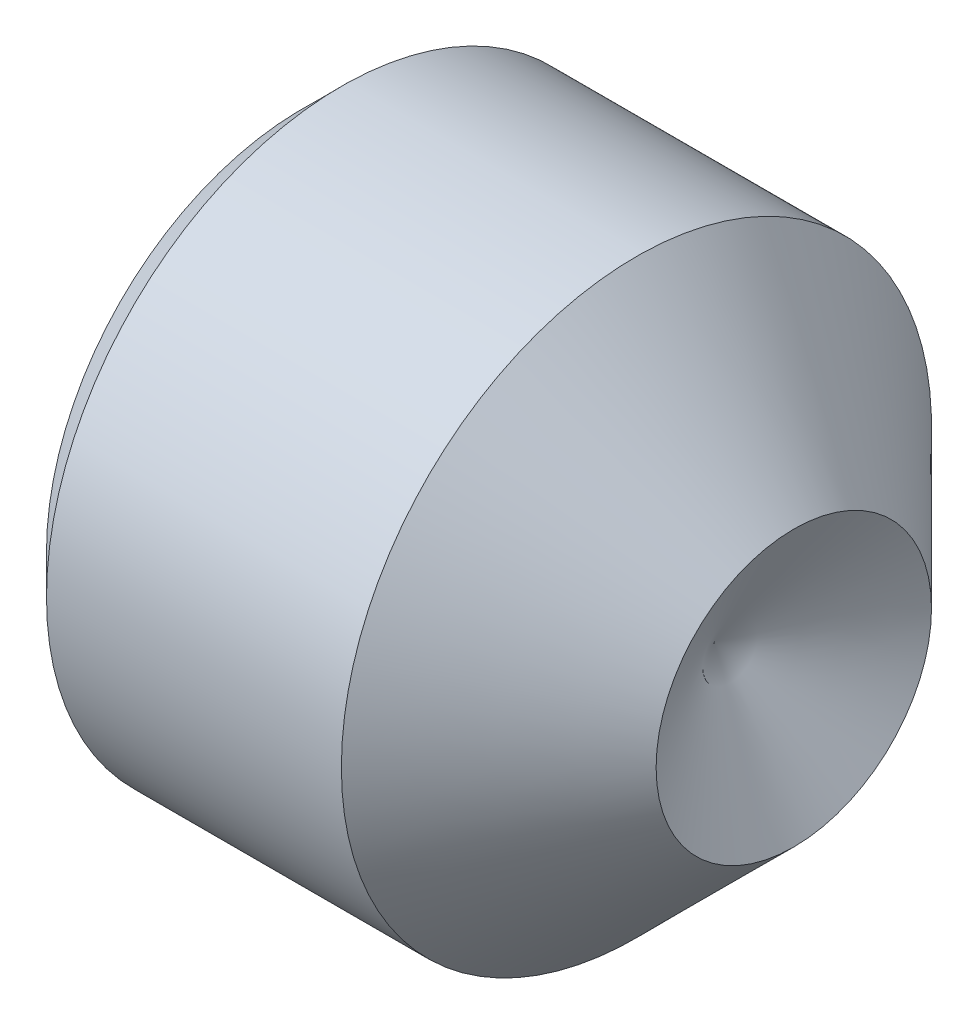
from build123d import *

# Parameters (mm, degrees)
CUT_EXTRUDE_1_DEPTH = 1.2


with BuildPart() as part:
    # 草图2 → Revolve 588 (revolve)
    with BuildSketch(Plane.XY, mode=Mode.PRIVATE) as revolve_588_sk:
        Polygon((0, 0), (2.5, 0), (2.5, 0.7), (1.7, 1.5), (0.201, 1.5), (0, 1.299), align=None)
    revolve(revolve_588_sk.sketch.rotate(Axis((-0.262128326, 0, 0), (1, 0, 0)), 90), axis=Axis((-0.262128326, 0, 0), (1, 0, 0)))

    # 草图3 → 切除-拉伸1 (cut)
    with BuildSketch(Plane.ZY):
        Polygon((0.865, 0), (0.4325, 0.749111974), (-0.4325, 0.749111974), (-0.865, 0), (-0.4325, -0.749111974), (0.4325, -0.749111974), align=None)
    extrude(amount=-CUT_EXTRUDE_1_DEPTH, mode=Mode.SUBTRACT)

    # 草图4 → 切除-旋转1 (revolve, cut)
    with BuildSketch(Plane.XY, mode=Mode.PRIVATE) as cut_revolve_1_sk:
        Polygon((1.2, 0.749111974), (1.6325, 0), (1.2, 0), align=None)
    revolve(cut_revolve_1_sk.sketch.rotate(Axis((-0.121283255, 0, 0), (1, 0, 0)), 90), axis=Axis((-0.121283255, 0, 0), (1, 0, 0)), mode=Mode.SUBTRACT)

    # 草图6 → 切除-旋转2 (revolve, cut)
    with BuildSketch(Plane.XY):
        Polygon((2.5, 0), (2.5, 0.7), (2.095854812, 0), align=None)
    revolve(axis=Axis((-1.727695698, 0, 0), (1, 0, 0)), mode=Mode.SUBTRACT)


solid = part.part
